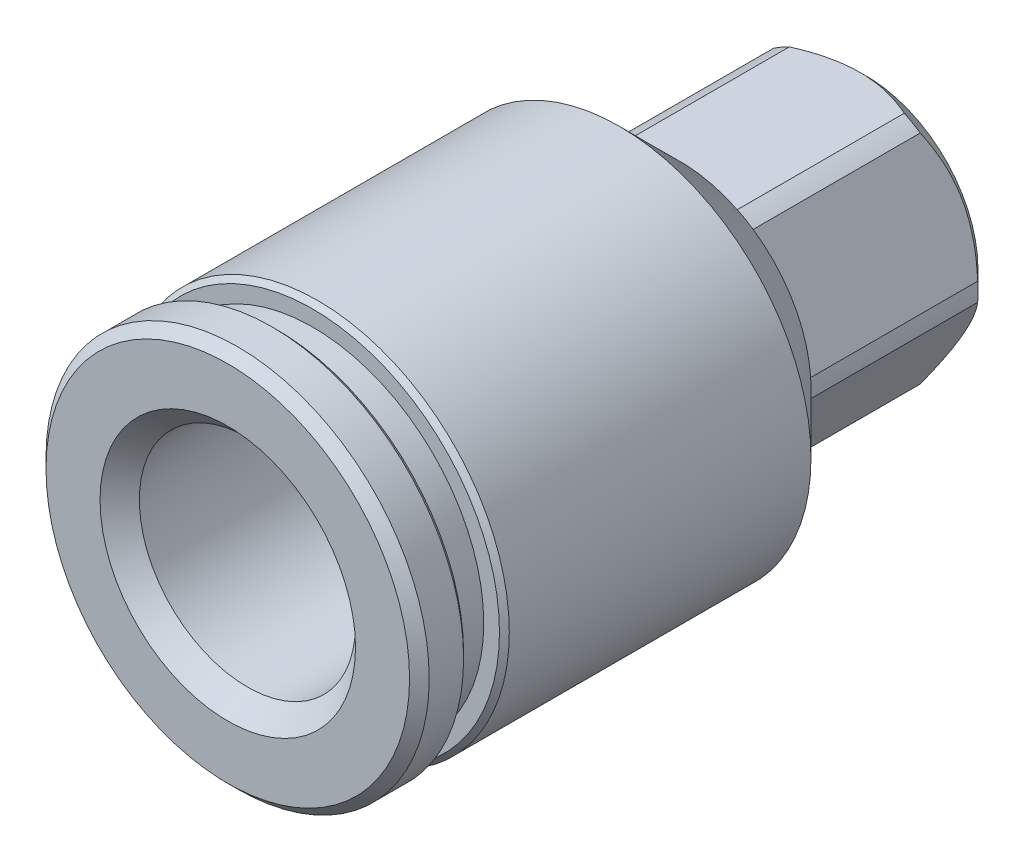
from build123d import *

# Parameters (mm, degrees)
SKETCH2_OUTSIDE_W  = 58.05
SKETCH2_OUTSIDE_H  = 58.05
CUT_EXTRUDE1_DEPTH = 19


with BuildPart() as part:
    # Sketch1 → Revolve1 (revolve)
    with BuildSketch(Plane(origin=(0, 0, 0), x_dir=(0, 0, -1), z_dir=(1, 0, 0)), mode=Mode.PRIVATE) as revolve1_sk:
        with BuildLine():
            Line((35, 0), (35, 11.7))
            ThreePointArc((35, 11.7), (34.765685425, 12.265685425), (34.2, 12.5))
            Line((34.2, 12.5), (30.943915758, 12.5))
            Line((30.943915758, 12.5), (28, 11))
            Line((28, 11), (2, 11))
            Line((2, 11), (0, 13))
            Line((0, 13), (0, 18.5))
            Line((0, 18.5), (1, 19.5))
            Line((1, 19.5), (4.5, 19.5))
            Line((4.5, 19.5), (5, 19))
            Line((5, 19), (5, 17.4))
            Line((5, 17.4), (8.65, 17.4))
            Line((8.65, 17.4), (8.65, 19))
            Line((8.65, 19), (9.15, 19.5))
            Line((9.15, 19.5), (39.85, 19.5))
            Line((39.85, 19.5), (46, 13.35))
            Line((46, 13.35), (63, 13.35))
            Line((63, 13.35), (65, 11.35))
            Line((65, 11.35), (65, 0))
            Line((65, 0), (35, 0))
        make_face()
    revolve(revolve1_sk.sketch.rotate(Axis((0, 0, 0), (0, 0, -1)), 90), axis=Axis((0, 0, 0), (0, 0, -1)))

    # Sketch2 outside → Cut-Extrude1 (cut)
    with BuildSketch(Plane(origin=(0, 0, -65), x_dir=(-1, 0, 0), z_dir=(0, 0, -1))):
        Rectangle(SKETCH2_OUTSIDE_W, SKETCH2_OUTSIDE_H)
        Polygon((-13.856406461, 0), (-6.92820323, -12), (6.92820323, -12), (13.856406461, 0), (6.92820323, 12), (-6.92820323, 12), align=None, mode=Mode.SUBTRACT)
    extrude(amount=-CUT_EXTRUDE1_DEPTH, mode=Mode.SUBTRACT)


solid = part.part
